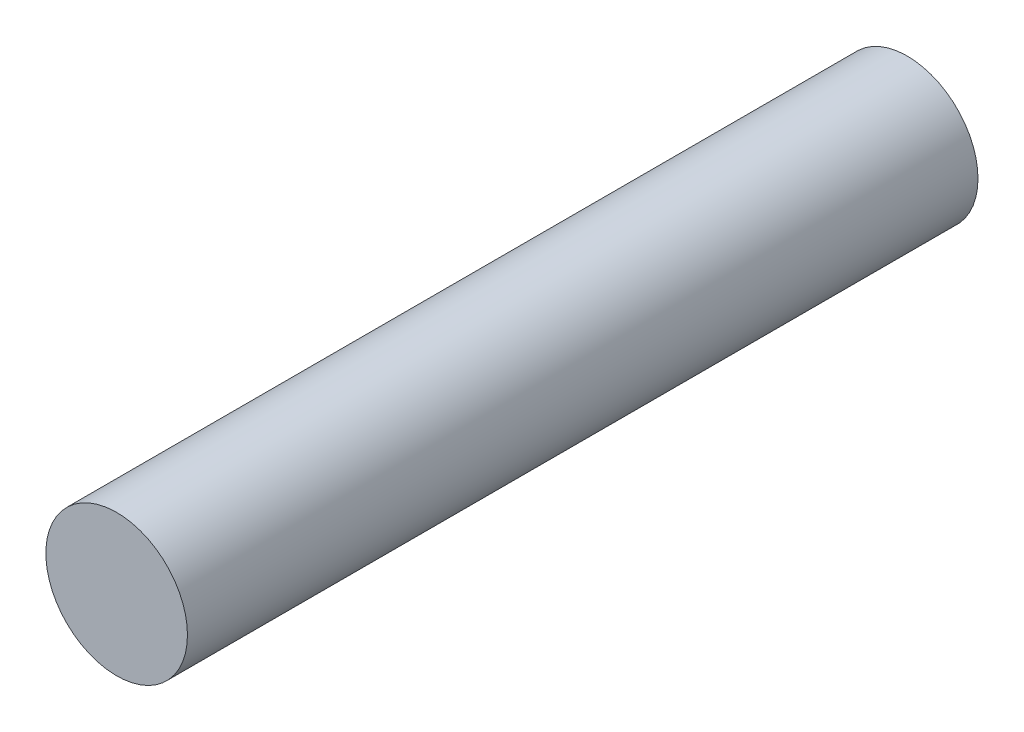
from build123d import *

# Parameters (mm, degrees)
SKETCH1_R           = 6
BOSS_EXTRUDE1_DEPTH = 67


with BuildPart() as part:
    # Sketch1 → Boss-Extrude1 (new body)
    with BuildSketch(Plane.XY):
        Circle(SKETCH1_R)
    extrude(amount=BOSS_EXTRUDE1_DEPTH)


solid = part.part
